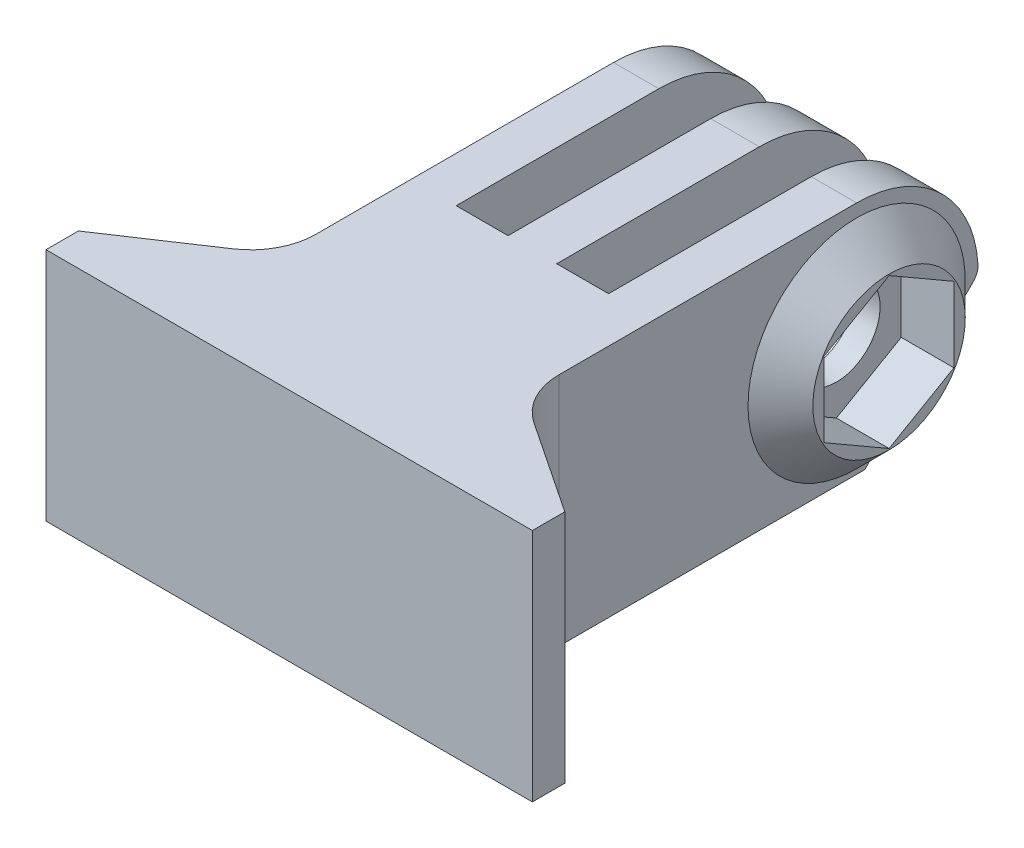
from build123d import *

# Parameters (mm, degrees)
SKETCH1_R           = 2.7
MAIN_BOSS_DEPTH     = 15
SKETCH2_W           = 3.2
SKETCH2_H           = 18
CUT_FINGERS_DEPTH   = 31.565503431
CUT_SLANT_DEPTH     = 28.667670665
FILLET1_R           = 1
CUT_EXTRUDE3_DEPTH  = 28.667670665
CUT_EXTRUDE4_DEPTH  = 3.25
BOSS_EXTRUDE2_DEPTH = 15
FILLET2_R           = 4
CHAMFER1_SIZE       = 0.5
CUT_EXTRUDE5_DEPTH  = 0.3
CHAMFER2_SIZE       = 2


with BuildPart() as part:
    # Sketch1 → main boss (new body)
    with BuildSketch(Plane(origin=(0, 0, 0), x_dir=(0, 0, -1), z_dir=(1, 0, 0))):
        with BuildLine():
            Line((0, 7.5), (-20.5, 7.5))
            Line((-20.5, 7.5), (-20.5, -7.5))
            Line((-20.5, -7.5), (0, -7.5))
            ThreePointArc((0, -7.5), (7.5, 0), (0, 7.5))
        make_face()
        Circle(SKETCH1_R, mode=Mode.SUBTRACT)
    extrude(amount=MAIN_BOSS_DEPTH)

    # Sketch6 → revolve nut seat (revolve)
    with BuildSketch(Plane(origin=(0, 0, 0), x_dir=(1, 0, 0), z_dir=(0, 1, 0))):
        Polygon((15, 2.7), (15, 6.7), (17, 4.7), (17, 2.7), align=None)
    revolve(axis=Axis((15.75, 0, 0), (-1, 0, 0)))

    # Sketch2 → cut fingers (cut, through all)
    with BuildSketch(Plane(origin=(0, 7.5, 0), x_dir=(1, 0, 0), z_dir=(0, 1, 0))):
        with Locations((4.4, -1.5)):
            Rectangle(SKETCH2_W, SKETCH2_H)
        with Locations((10.6, -1.5)):
            Rectangle(SKETCH2_W, SKETCH2_H)
    extrude(amount=-CUT_FINGERS_DEPTH, mode=Mode.SUBTRACT)

    # Sketch3 → cut slant (cut, through all)
    with BuildSketch(Plane(origin=(0, 0, 0), x_dir=(0, 0, -1), z_dir=(1, 0, 0))):
        Polygon((0, -7.5), (7.5, 0), (7.5, -7.5), align=None)
    extrude(amount=CUT_SLANT_DEPTH, mode=Mode.SUBTRACT)

    # Fillet1
    fillet1_edges = [part.edges().sort_by_distance(p)[0] for p in [
        (7.5, 0, -7.5),
        (13.6, 0, -7.5),
        (1.4, 0, -7.5),
    ]]
    fillet(fillet1_edges, radius=FILLET1_R)

    # Sketch4 → Cut-Extrude3 (cut, through all)
    with BuildSketch(Plane(origin=(0, 0, 0), x_dir=(0, 0, -1), z_dir=(1, 0, 0))):
        with BuildLine():
            Line((-1.909188309, 1.909188309), (0, 3.818376618))
            Line((0, 3.818376618), (1.909188309, 1.909188309))
            ThreePointArc((1.909188309, 1.909188309), (0, -2.7), (-1.909188309, 1.909188309))
        make_face()
    extrude(amount=CUT_EXTRUDE3_DEPTH, mode=Mode.SUBTRACT)

    # Sketch7 → Cut-Extrude4 (cut)
    with BuildSketch(Plane(origin=(17, 0, 0), x_dir=(0, 0, -1), z_dir=(1, 0, 0))):
        Polygon((0, 4.618802154), (-4, 2.309401077), (-4, -2.309401077), (0, -4.618802154), (4, -2.309401077), (4, 2.309401077), align=None)
    extrude(amount=-CUT_EXTRUDE4_DEPTH, mode=Mode.SUBTRACT)

    # Sketch8 → Boss-Extrude2 (add)
    with BuildSketch(Plane(origin=(0, 7.5, 0), x_dir=(1, 0, 0), z_dir=(0, 1, 0))):
        Polygon((0, -20.5), (-7.5, -25.5), (-7.5, -27.5), (22.5, -27.5), (22.5, -25.5), (15, -20.5), align=None)
    extrude(amount=-BOSS_EXTRUDE2_DEPTH)

    # Fillet2
    fillet2_edges = [part.edges().sort_by_distance(p)[0] for p in [
        (15, 0, 20.5),
        (0, 0, 20.5),
    ]]
    fillet(fillet2_edges, radius=FILLET2_R)

    # Chamfer1
    chamfer1_edges = [part.edges().sort_by_distance(p)[0] for p in [
        (22.5, -7.5, 26.5),
        (7.5, -7.5, 27.5),
        (-7.5, -7.5, 26.5),
        (-4.640599608, -7.5, 23.593733072),
        (15, -7.5, 9.179632483),
        (19.640599608, -7.5, 23.593733072),
        (0, -7.5, 9.179632483),
        (15.473301605, -7.5, 20.246696668),
        (-0.473301605, -7.5, 20.246696668),
    ]]
    chamfer(chamfer1_edges, length=CHAMFER1_SIZE)

    # Sketch9 → Cut-Extrude5 (cut)
    with BuildSketch(Plane.ZY):
        with BuildLine():
            add(Edge.make_bspline(
                [(3.598615092, -0.137753793), (3.600861533, -0.157183898), (3.605212132, -0.194813452), (3.617402473, -0.230668748), (3.623298304, -0.248010081)],
                knots=[0, 0, 0, 0, 1.032704525, 2, 2, 2, 2], degree=3))
            Line((3.623298304, -0.248010081), (4.820878335, -3.82937322))
            add(Edge.make_bspline(
                [(4.820878335, -3.82937322), (4.833968844, -3.860786681), (4.858885706, -3.920579992), (4.92684607, -3.989302981), (5.010570031, -4.036409054), (5.07428542, -4.044841249), (5.107444646, -4.049229594)],
                knots=[0, 0, 0, 0, 1.054683453, 2.007515722, 2.96305683, 4, 4, 4, 4], degree=3))
            add(Edge.make_bspline(
                [(5.107444646, -4.049229594), (5.142208057, -4.044914191), (5.208251352, -4.036715817), (5.295006986, -3.990100137), (5.363178355, -3.920563185), (5.388213131, -3.860977658), (5.401347085, -3.829717398)],
                knots=[0, 0, 0, 0, 1.06836729, 2.029677035, 2.966312611, 4, 4, 4, 4], degree=3))
            Line((5.401347085, -3.829717398), (6.599482089, -0.24707282))
            add(Edge.make_bspline(
                [(6.599482089, -0.24707282), (6.603925604, -0.229993676), (6.613210528, -0.194306037), (6.61503165, -0.157464272), (6.615981231, -0.138253984)],
                knots=[0, 0, 0, 0, 0.957146177, 2, 2, 2, 2], degree=3))
            add(Edge.make_bspline(
                [(6.615981231, -0.138253984), (6.614357849, -0.118183713), (6.611216064, -0.079341075), (6.592915667, -0.024113937), (6.566498982, 0.026811979), (6.527982565, 0.070293413), (6.482706539, 0.10700648), (6.431598572, 0.135990492), (6.373315004, 0.15155134), (6.333133019, 0.155053956), (6.312322695, 0.156867967)],
                knots=[0, 0, 0, 0, 1.027789528, 1.989114056, 2.957849911, 3.946954469, 4.938684973, 5.935646619, 6.930867606, 8, 8, 8, 8], degree=3))
            add(Edge.make_bspline(
                [(6.312322695, 0.156867967), (6.279244823, 0.152348207), (6.215877812, 0.143689738), (6.130933831, 0.098411539), (6.064288611, 0.028214265), (6.038963122, -0.031473392), (6.025737329, -0.062644228)],
                knots=[0, 0, 0, 0, 1.03692919, 1.986436811, 2.948451835, 4, 4, 4, 4], degree=3))
            Line((6.025737329, -0.062644228), (5.107477992, -2.795047048))
            Line((5.107477992, -2.795047048), (4.197102611, -0.06207139))
            add(Edge.make_bspline(
                [(4.197102611, -0.06207139), (4.183650935, -0.031083172), (4.157752816, 0.028577541), (4.089741615, 0.098864615), (4.001781961, 0.144038424), (3.936047031, 0.152435399), (3.901347085, 0.156867967)],
                knots=[0, 0, 0, 0, 1.028913269, 1.980936724, 2.934183284, 4, 4, 4, 4], degree=3))
            add(Edge.make_bspline(
                [(3.901347085, 0.156867967), (3.881347821, 0.155035494), (3.842372562, 0.151464307), (3.785372744, 0.135764807), (3.734476606, 0.106687508), (3.688135685, 0.070383914), (3.648559745, 0.026854907), (3.620540286, -0.023787744), (3.602527697, -0.07937841), (3.599337135, -0.118196433), (3.597688548, -0.138253984)],
                knots=[0, 0, 0, 0, 1.030543514, 2.008358934, 3.007991962, 4.018680577, 5.024181706, 6.005556065, 6.969456486, 8, 8, 8, 8], degree=3))
            Line((3.597688548, -0.138253984), (3.598615092, -0.137753793))
        make_face()
        with BuildLine():
            add(Edge.make_bspline(
                [(8.140118998, 0.676006211), (8.126118238, 0.662051329), (8.098394784, 0.634418721), (8.068616857, 0.583150569), (8.051458942, 0.5253953), (8.048168392, 0.485030727), (8.046469036, 0.464185041)],
                knots=[0, 0, 0, 0, 0.992164211, 1.96462331, 2.948859839, 4, 4, 4, 4], degree=3))
            add(Edge.make_bspline(
                [(8.046469036, 0.464185041), (8.048108642, 0.443313266), (8.051283496, 0.402898178), (8.069252031, 0.345538943), (8.095900728, 0.293036542), (8.134511672, 0.24857423), (8.178978282, 0.209937224), (8.231489504, 0.183387231), (8.288766074, 0.165050875), (8.329244314, 0.162870764), (8.350127573, 0.161746016)],
                knots=[0, 0, 0, 0, 1.0530203, 2.0390173, 3.01127151, 4.001099292, 4.990927074, 5.963181283, 6.949178283, 8, 8, 8, 8], degree=3))
            add(Edge.make_bspline(
                [(8.350127573, 0.161746016), (8.371812081, 0.163820015), (8.413894836, 0.167844989), (8.473092296, 0.186468461), (8.52609959, 0.214753151), (8.555087707, 0.241168443), (8.569639768, 0.254428943)],
                knots=[0, 0, 0, 0, 1.06971459, 2.075976935, 3.034138695, 4, 4, 4, 4], degree=3))
            Line((8.569639768, 0.254428943), (9.26569779, 0.966780077))
            Line((9.26569779, 0.966780077), (9.26569779, -3.745281661))
            add(Edge.make_bspline(
                [(9.26569779, -3.745281661), (9.266939982, -3.76625477), (9.269341868, -3.806808099), (9.287536453, -3.864269137), (9.314312482, -3.916272088), (9.351485796, -3.96162552), (9.39592986, -3.99936045), (9.447235323, -4.026500737), (9.503466034, -4.044402219), (9.543079151, -4.0475853), (9.563542207, -4.049229594)],
                knots=[0, 0, 0, 0, 1.064897874, 2.059072668, 3.039390689, 4.024276954, 5.022314302, 5.984364611, 6.958777708, 8, 8, 8, 8], degree=3))
            add(Edge.make_bspline(
                [(9.563542207, -4.049229594), (9.583989615, -4.047534222), (9.623960516, -4.044220084), (9.680760948, -4.026784818), (9.73233246, -3.999317936), (9.776950772, -3.961693857), (9.813632832, -3.915895521), (9.842677475, -3.864862735), (9.858222119, -3.806559075), (9.861727015, -3.766379917), (9.863542207, -3.745571057)],
                knots=[0, 0, 0, 0, 1.038553346, 2.030179789, 2.989764092, 3.985243189, 4.967604913, 5.955148361, 6.940967594, 8, 8, 8, 8], degree=3))
            Line((9.863542207, -3.745571057), (9.863542207, 1.651448046))
            add(Edge.make_bspline(
                [(9.863542207, 1.651448046), (9.861678502, 1.671617066), (9.858026132, 1.711143043), (9.842701379, 1.768862853), (9.813569211, 1.819802235), (9.777342297, 1.865741725), (9.731903085, 1.901978232), (9.68080757, 1.929533279), (9.624022822, 1.947259356), (9.583996319, 1.949582994), (9.563542207, 1.950770406)],
                knots=[0, 0, 0, 0, 1.033276339, 2.024949948, 3.018358012, 4.006553579, 4.994749146, 5.960032027, 6.957547333, 8, 8, 8, 8], degree=3))
            add(Edge.make_bspline(
                [(9.563542207, 1.950770406), (9.543092802, 1.949583097), (9.503464471, 1.947282244), (9.446922073, 1.929795471), (9.397181662, 1.89990847), (9.369952183, 1.872915042), (9.356225134, 1.859306992)],
                knots=[0, 0, 0, 0, 1.049879887, 2.034532876, 3.009159723, 4, 4, 4, 4], degree=3))
            Line((9.356225134, 1.859306992), (8.140118998, 0.676006211))
        make_face()
        with BuildLine():
            add(Edge.make_bspline(
                [(11.282034966, -3.73380467), (11.283109126, -3.754936724), (11.285198772, -3.796046531), (11.303150082, -3.854188898), (11.330436323, -3.907023359), (11.368158138, -3.952715592), (11.413527282, -3.990976464), (11.465572734, -4.019623959), (11.523837088, -4.037122919), (11.564642422, -4.039485672), (11.585493426, -4.040693008)],
                knots=[0, 0, 0, 0, 1.053795159, 2.050028647, 3.013195991, 4.009429478, 4.990006149, 5.962765968, 6.958999455, 8, 8, 8, 8], degree=3))
            add(Edge.make_bspline(
                [(11.585493426, -4.040693008), (11.606358717, -4.039536184), (11.646802127, -4.037293901), (11.704511557, -4.019342215), (11.756246907, -3.991001483), (11.801608238, -3.95270881), (11.839327844, -3.907024851), (11.866630529, -3.854189459), (11.884439377, -3.796289407), (11.886751159, -3.755459174), (11.887932451, -3.734595447)],
                knots=[0, 0, 0, 0, 1.045213593, 2.025948432, 3.002645121, 3.987190297, 4.987455656, 5.954521048, 6.954786407, 8, 8, 8, 8], degree=3))
            Line((11.887932451, -3.734595447), (11.888951887, -3.435441007))
            add(Edge.make_bspline(
                [(11.888951887, -3.435441007), (11.887372969, -3.413890468), (11.884304943, -3.372015192), (11.866597476, -3.312676618), (11.840011181, -3.258851808), (11.801479388, -3.214042592), (11.756213068, -3.176814085), (11.704184731, -3.150073692), (11.646840507, -3.13182046), (11.606371779, -3.129628663), (11.585493426, -3.128497886)],
                knots=[0, 0, 0, 0, 1.076562654, 2.091889952, 3.072719245, 4.052917712, 5.020200157, 5.982996012, 6.959400964, 8, 8, 8, 8], degree=3))
            add(Edge.make_bspline(
                [(11.585493426, -3.128497886), (11.564629339, -3.129679196), (11.5237984, -3.131991014), (11.465903411, -3.149799607), (11.413560405, -3.176839234), (11.368290459, -3.214036164), (11.329739641, -3.258851932), (11.303234331, -3.312682653), (11.285179249, -3.372075424), (11.282972726, -3.414129136), (11.28183489, -3.435814959)],
                knots=[0, 0, 0, 0, 1.037498569, 2.03038068, 2.990307883, 3.954708309, 4.931986273, 5.909893183, 6.922195311, 8, 8, 8, 8], degree=3))
            Line((11.28183489, -3.435814959), (11.282034966, -3.73380467))
        make_face()
        with BuildLine():
            add(Edge.make_bspline(
                [(13.369387291, 0.676006211), (13.355386531, 0.662051329), (13.327663077, 0.634418721), (13.29788515, 0.583150569), (13.280727235, 0.5253953), (13.277436685, 0.485030727), (13.275737329, 0.464185041)],
                knots=[0, 0, 0, 0, 0.992164211, 1.96462331, 2.948859839, 4, 4, 4, 4], degree=3))
            add(Edge.make_bspline(
                [(13.275737329, 0.464185041), (13.277376935, 0.443313266), (13.280551789, 0.402898178), (13.298520324, 0.345538943), (13.325169021, 0.293036542), (13.363779965, 0.24857423), (13.408246574, 0.209937224), (13.460757796, 0.183387231), (13.518034367, 0.165050875), (13.558512606, 0.162870764), (13.579395865, 0.161746016)],
                knots=[0, 0, 0, 0, 1.0530203, 2.0390173, 3.01127151, 4.001099292, 4.990927074, 5.963181283, 6.949178283, 8, 8, 8, 8], degree=3))
            add(Edge.make_bspline(
                [(13.579395865, 0.161746016), (13.601080373, 0.163820015), (13.643163129, 0.167844989), (13.702360588, 0.186468461), (13.755367883, 0.214753151), (13.784356, 0.241168443), (13.798908061, 0.254428943)],
                knots=[0, 0, 0, 0, 1.06971459, 2.075976935, 3.034138695, 4, 4, 4, 4], degree=3))
            Line((13.798908061, 0.254428943), (14.494966083, 0.966780077))
            Line((14.494966083, 0.966780077), (14.494966083, -3.745281661))
            add(Edge.make_bspline(
                [(14.494966083, -3.745281661), (14.496208275, -3.76625477), (14.498610161, -3.806808099), (14.516804746, -3.864269137), (14.543580775, -3.916272088), (14.580754088, -3.96162552), (14.625198152, -3.99936045), (14.676503616, -4.026500737), (14.732734327, -4.044402219), (14.772347443, -4.0475853), (14.7928105, -4.049229594)],
                knots=[0, 0, 0, 0, 1.064897874, 2.059072668, 3.039390689, 4.024276954, 5.022314302, 5.984364611, 6.958777708, 8, 8, 8, 8], degree=3))
            add(Edge.make_bspline(
                [(14.7928105, -4.049229594), (14.813257907, -4.047534222), (14.853228809, -4.044220084), (14.91002924, -4.026784818), (14.961600753, -3.999317936), (15.006219065, -3.961693857), (15.042901124, -3.915895521), (15.071945767, -3.864862735), (15.087490411, -3.806559075), (15.090995307, -3.766379917), (15.0928105, -3.745571057)],
                knots=[0, 0, 0, 0, 1.038553346, 2.030179789, 2.989764092, 3.985243189, 4.967604913, 5.955148361, 6.940967594, 8, 8, 8, 8], degree=3))
            Line((15.0928105, -3.745571057), (15.0928105, 1.651448046))
            add(Edge.make_bspline(
                [(15.0928105, 1.651448046), (15.090946795, 1.671617066), (15.087294425, 1.711143043), (15.071969671, 1.768862853), (15.042837504, 1.819802235), (15.006610589, 1.865741725), (14.961171377, 1.901978232), (14.910075863, 1.929533279), (14.853291115, 1.947259356), (14.813264612, 1.949582994), (14.7928105, 1.950770406)],
                knots=[0, 0, 0, 0, 1.033276339, 2.024949948, 3.018358012, 4.006553579, 4.994749146, 5.960032027, 6.957547333, 8, 8, 8, 8], degree=3))
            add(Edge.make_bspline(
                [(14.7928105, 1.950770406), (14.772361094, 1.949583097), (14.732732764, 1.947282244), (14.676190366, 1.929795471), (14.626449954, 1.89990847), (14.599220476, 1.872915042), (14.585493426, 1.859306992)],
                knots=[0, 0, 0, 0, 1.049879887, 2.034532876, 3.009159723, 4, 4, 4, 4], degree=3))
            Line((14.585493426, 1.859306992), (13.369387291, 0.676006211))
        make_face()
    extrude(amount=-CUT_EXTRUDE5_DEPTH, mode=Mode.SUBTRACT)

    # Chamfer2
    chamfer2_edges = [part.edges().sort_by_distance(p)[0] for p in [
        (4.4, 7.5, 10.5),
        (4.4, -7.5, 10.5),
        (10.6, 7.5, 10.5),
        (10.6, -7.5, 10.5),
    ]]
    chamfer(chamfer2_edges, length=CHAMFER2_SIZE)


solid = part.part
